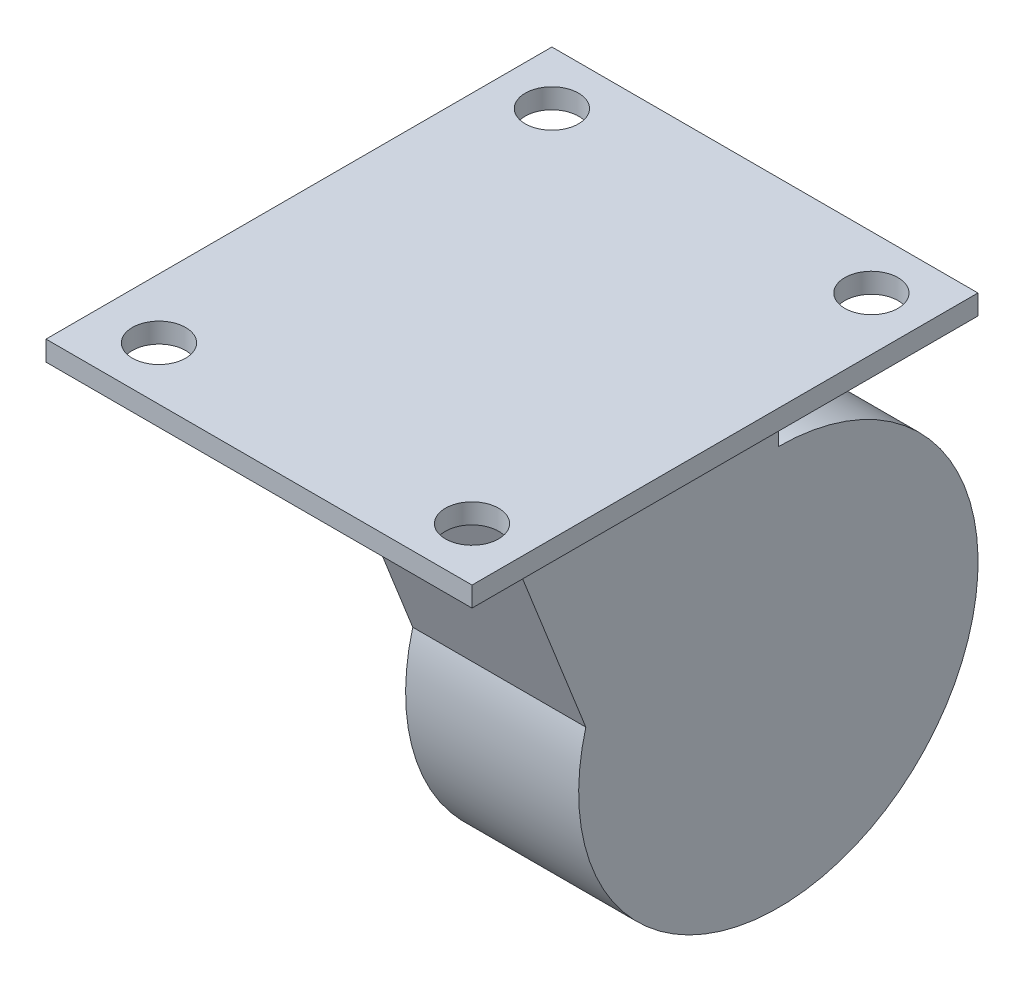
from build123d import *

# Parameters (mm, degrees)
SKETCH1_W                = 32
SKETCH1_H                = 38
SKETCH1_R                = 2
BOSS_EXTRUDE1_DEPTH      = 1.5
BOSS_EXTRUDE2_DEPTH      = 6.5
BOSS_EXTRUDE2_DEPTH_BACK = 6.5
SKETCH2_R                = 15


with BuildPart() as part:
    # Sketch1 → Boss-Extrude1 (new body)
    with BuildSketch(Plane(origin=(0, 0, 0), x_dir=(1, 0, 0), z_dir=(0, 1, 0))):
        with Locations((3.177060701, -4.044161192)):
            Rectangle(SKETCH1_W, SKETCH1_H)
        with Locations(Location((-8.822939299, 10.955838808, 0), (0, 0, 270))):
            Circle(SKETCH1_R, mode=Mode.SUBTRACT)
        with Locations(Location((15.177060701, 10.955838808, 0), (0, 0, 270))):
            Circle(SKETCH1_R, mode=Mode.SUBTRACT)
        with Locations(Location((15.177060701, -19.044161192, 0), (0, 0, 270))):
            Circle(SKETCH1_R, mode=Mode.SUBTRACT)
        with Locations(Location((-8.33660746, -19.044161192, 0), (0, 0, 270))):
            Circle(SKETCH1_R, mode=Mode.SUBTRACT)
    extrude(amount=-BOSS_EXTRUDE1_DEPTH)

    # Sketch2 → Boss-Extrude2 (add, two sides: drawn at the far end of the back side and taken through both)
    with BuildSketch(Plane.ZY.offset(-3.177060701).offset(-BOSS_EXTRUDE2_DEPTH_BACK)):
        with Locations((-9.466353074, -27)):
            Circle(SKETCH2_R)
        with BuildLine():
            Line((13.494241004, -1.5), (-9.466353074, -1.5))
            Line((-9.466353074, -1.5), (-9.466353074, -12))
            ThreePointArc((-9.466353074, -12), (-0.375906326, -15.068370693), (4.99549237, -23.018162943))
            Line((4.99549237, -23.018162943), (13.494241004, -1.5))
        make_face()
    extrude(amount=BOSS_EXTRUDE2_DEPTH + BOSS_EXTRUDE2_DEPTH_BACK)


solid = part.part
